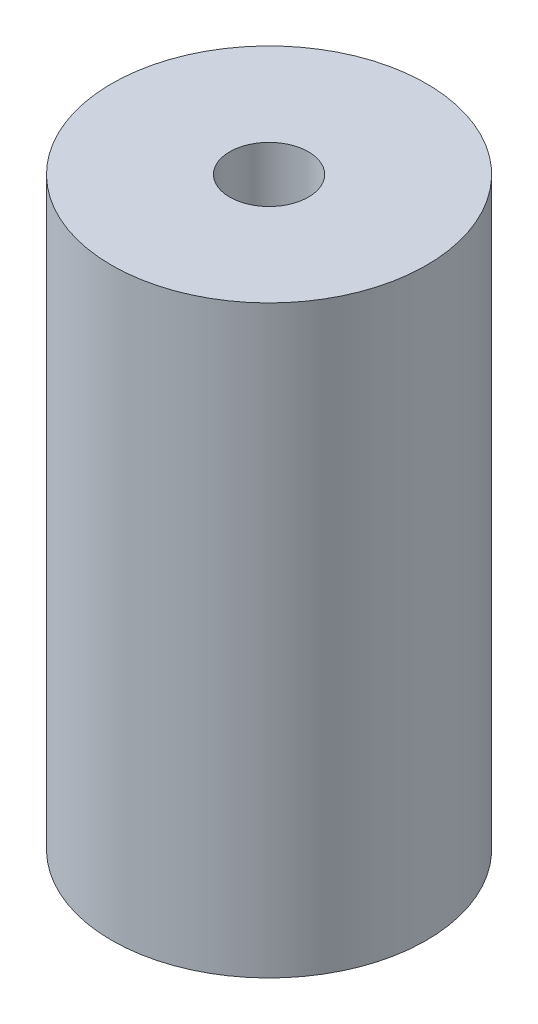
from build123d import *

# Parameters (mm, degrees)
SKETCH1_R           = 8.89
SKETCH1_R_2         = 2.2225
BOSS_EXTRUDE1_DEPTH = 33.02


with BuildPart() as part:
    # Sketch1 → Boss-Extrude1 (new body)
    with BuildSketch(Plane(origin=(0, 0, 0), x_dir=(1, 0, 0), z_dir=(0, 1, 0))):
        with Locations(Location((0, 0, 0), (0, 0, 270))):
            Circle(SKETCH1_R)
        with Locations(Location((0, 0, 0), (0, 0, 270))):
            Circle(SKETCH1_R_2, mode=Mode.SUBTRACT)
    extrude(amount=BOSS_EXTRUDE1_DEPTH)


solid = part.part
